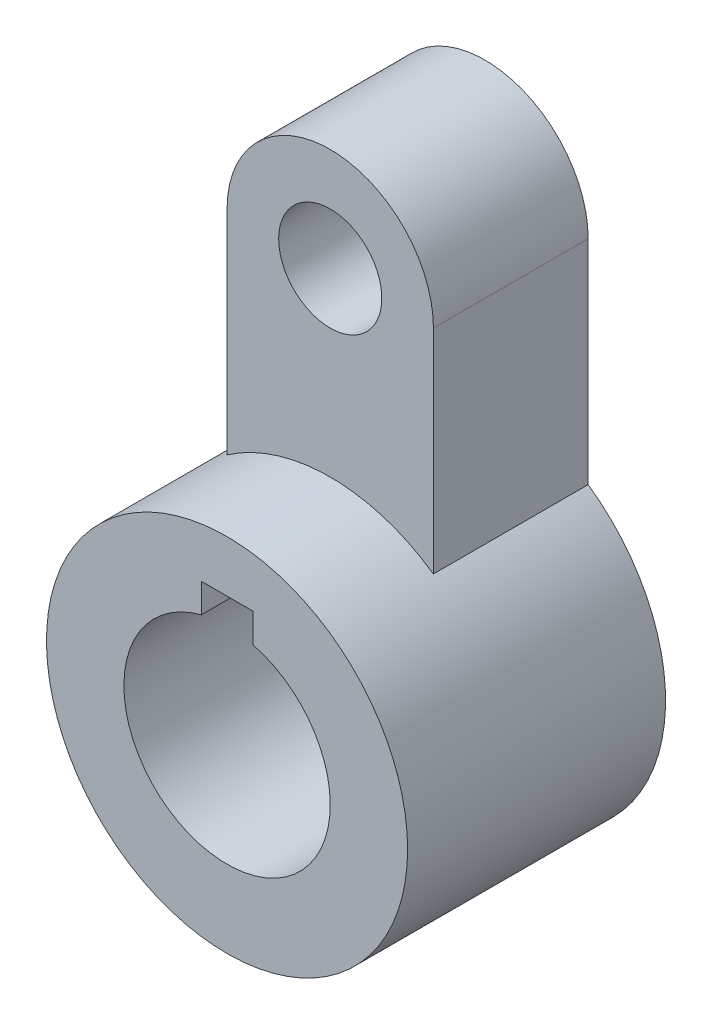
from build123d import *

# Parameters (mm, degrees)
SKETCH1_R           = 22.225
BOSS_EXTRUDE1_DEPTH = 31.75
SKETCH1_3_R         = 6.35
BOSS_EXTRUDE2_DEPTH = 19.05
CUT_EXTRUDE1_DEPTH  = 70.051688068


with BuildPart() as part:
    # Sketch1 → Boss-Extrude1 (new body)
    with BuildSketch(Plane.XY):
        Circle(SKETCH1_R)
    extrude(amount=BOSS_EXTRUDE1_DEPTH)

    # Sketch1<3> → Boss-Extrude2 (add)
    with BuildSketch(Plane.XY):
        with BuildLine():
            ThreePointArc((12.7, 44.45), (0, 57.15), (-12.7, 44.45))
            Line((-12.7, 44.45), (-12.7, 18.238986403))
            ThreePointArc((-12.7, 18.238986403), (0, 22.225), (12.7, 18.238986403))
            Line((12.7, 18.238986403), (12.7, 44.45))
        make_face()
        with Locations(Location((0, 44.45, 0), (0, 0, 180))):
            Circle(SKETCH1_3_R, mode=Mode.SUBTRACT)
    extrude(amount=BOSS_EXTRUDE2_DEPTH)

    # Sketch2 → Cut-Extrude1 (cut, through all)
    with BuildSketch(Plane.XY.offset(31.75)):
        with BuildLine():
            Line((0, 15.875), (0, -12.7))
            ThreePointArc((0, -12.7), (12.598777143, -1.600254515), (3.175, 12.296722124))
            Line((3.175, 12.296722124), (3.175, 15.875))
            Line((3.175, 15.875), (0, 15.875))
        make_face()
        with BuildLine():
            ThreePointArc((-3.175, 12.296722124), (-12.598777143, -1.600254515), (0, -12.7))
            Line((0, -12.7), (0, 15.875))
            Line((0, 15.875), (-3.175, 15.875))
            Line((-3.175, 15.875), (-3.175, 12.296722124))
        make_face()
    extrude(amount=-CUT_EXTRUDE1_DEPTH, mode=Mode.SUBTRACT)


solid = part.part
